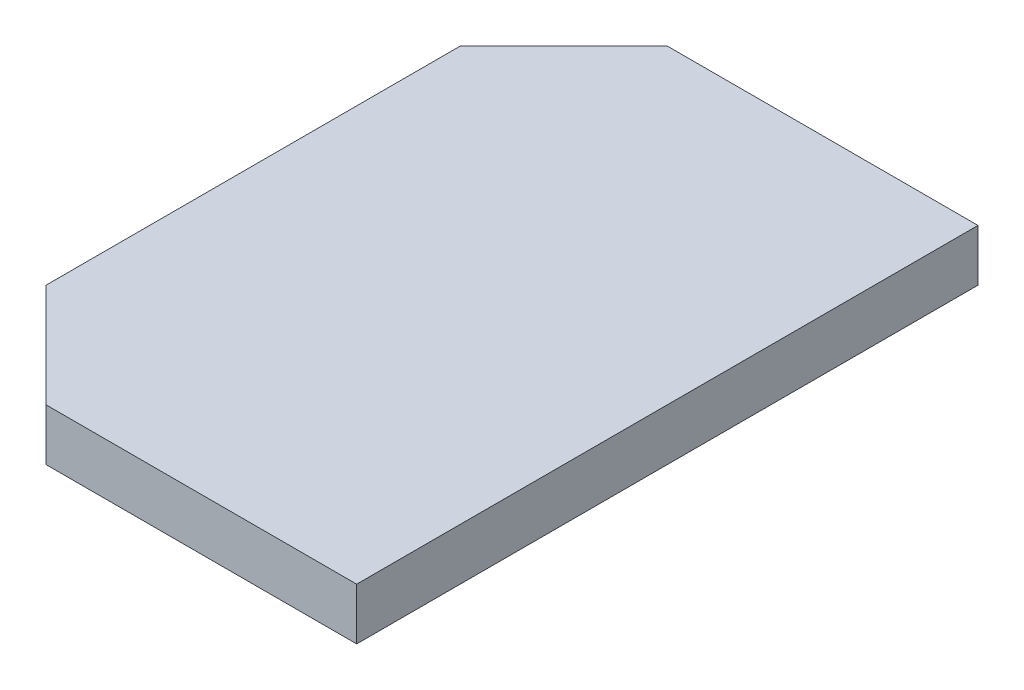
from build123d import *

# Parameters (mm, degrees)
BOSS_EXTRUDE1_DEPTH = 3.175


with BuildPart() as part:
    # Sketch1 → Boss-Extrude1 (new, symmetric)
    with BuildSketch(Plane(origin=(0, 0, 0), x_dir=(1, 0, 0), z_dir=(0, 1, 0))):
        Polygon((-12.7, 38.1), (-25.4, 25.4), (-25.4, -25.4), (-12.7, -38.1), (25.4, -38.1), (25.4, 38.1), align=None)
    extrude(amount=BOSS_EXTRUDE1_DEPTH, both=True)


solid = part.part
